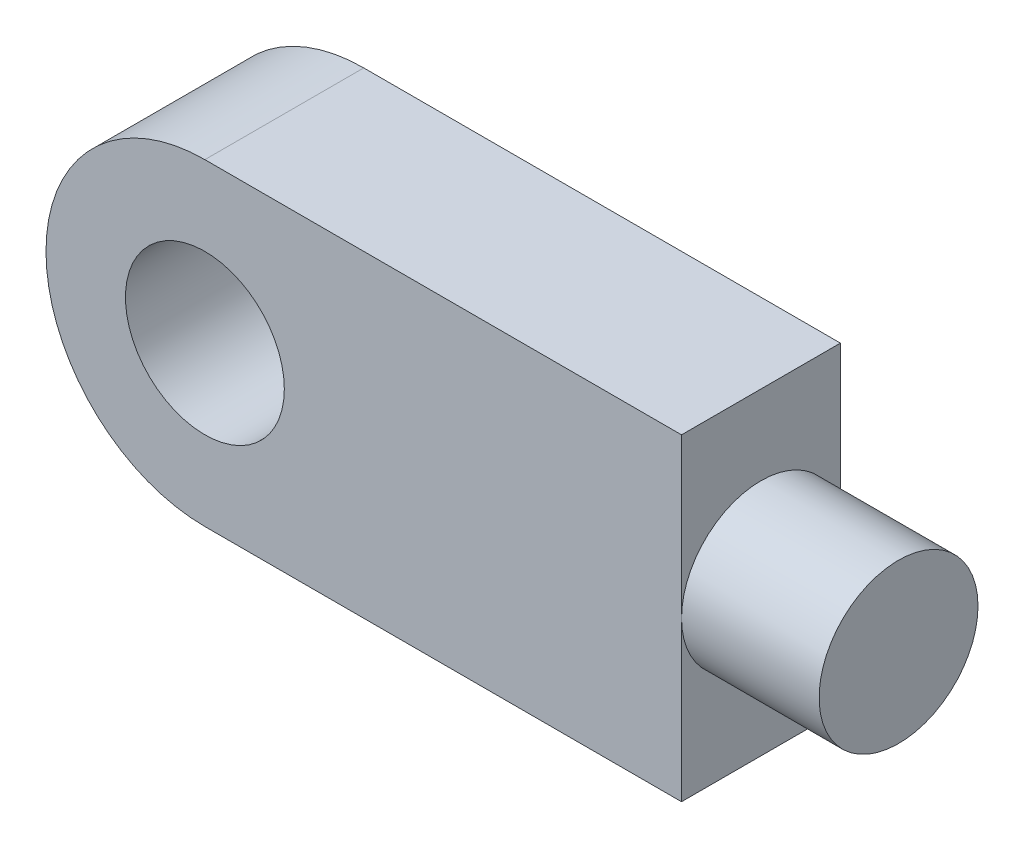
from build123d import *

# Parameters (mm, degrees)
SKETCH1_R                      = 25
BOSS_EXTRUDE1_DEPTH            = 25
CUT_EXTRUDE1_DEPTH             = 50
CUT_EXTRUDE2_REACH             = 138.931
SKETCH3_W                      = 6.698729811
SKETCH3_H                      = 50
CUT_EXTRUDE2_DIRECTION_2_REACH = 138.931


with BuildPart() as part:
    # Sketch1 → Boss-Extrude1 (new, symmetric)
    with BuildSketch(Plane.XY):
        with BuildLine():
            Line((-75, 50), (75, 50))
            ThreePointArc((75, 50), (125, 0), (75, -50))
            Line((75, -50), (-75, -50))
            ThreePointArc((-75, -50), (-125, 0), (-75, 50))
        make_face()
        with Locations((-75, 0)):
            Circle(SKETCH1_R, mode=Mode.SUBTRACT)
    extrude(amount=BOSS_EXTRUDE1_DEPTH, both=True)

    # Sketch2 → Cut-Extrude1 (cut)
    with BuildSketch(Plane(origin=(75, 0, 0), x_dir=(0, 0, -1), z_dir=(1, 0, 0))):
        with BuildLine():
            Line((25, 50), (-25, 50))
            Line((-25, 50), (-25, -5.1e-08))
            ThreePointArc((-25, -5.1e-08), (-2.6e-08, 25), (25, 0))
            Line((25, 0), (25, 50))
        make_face()
        with BuildLine():
            ThreePointArc((25, 0), (2.6e-08, -25), (-25, -5.1e-08))
            Line((-25, -5.1e-08), (-25, -50))
            Line((-25, -50), (25, -50))
            Line((25, -50), (25, 0))
        make_face()
    extrude(amount=CUT_EXTRUDE1_DEPTH, mode=Mode.SUBTRACT)

    # Sketch3 → Cut-Extrude2 (cut, up to next)
    with BuildSketch(Plane.XY, mode=Mode.PRIVATE) as cut_extrude2_sk1:
        with Locations((121.650635095, 0)):
            Rectangle(SKETCH3_W, SKETCH3_H)
    cut_extrude2_tool1 = extrude(cut_extrude2_sk1.sketch, amount=-CUT_EXTRUDE2_REACH, mode=Mode.PRIVATE) & part.part
    add(cut_extrude2_tool1.solids().sort_by_distance((121.650635, 0, 0))[0], mode=Mode.SUBTRACT)

    # Sketch3 → Cut-Extrude2 direction 2 (cut, up to next)
    with BuildSketch(Plane.XY, mode=Mode.PRIVATE) as cut_extrude2_direction_2_sk1:
        with Locations((121.650635095, 0)):
            Rectangle(SKETCH3_W, SKETCH3_H)
    cut_extrude2_direction_2_tool1 = extrude(cut_extrude2_direction_2_sk1.sketch, amount=CUT_EXTRUDE2_DIRECTION_2_REACH, mode=Mode.PRIVATE) & part.part
    add(cut_extrude2_direction_2_tool1.solids().sort_by_distance((121.650635, 0, 0))[0], mode=Mode.SUBTRACT)


solid = part.part
